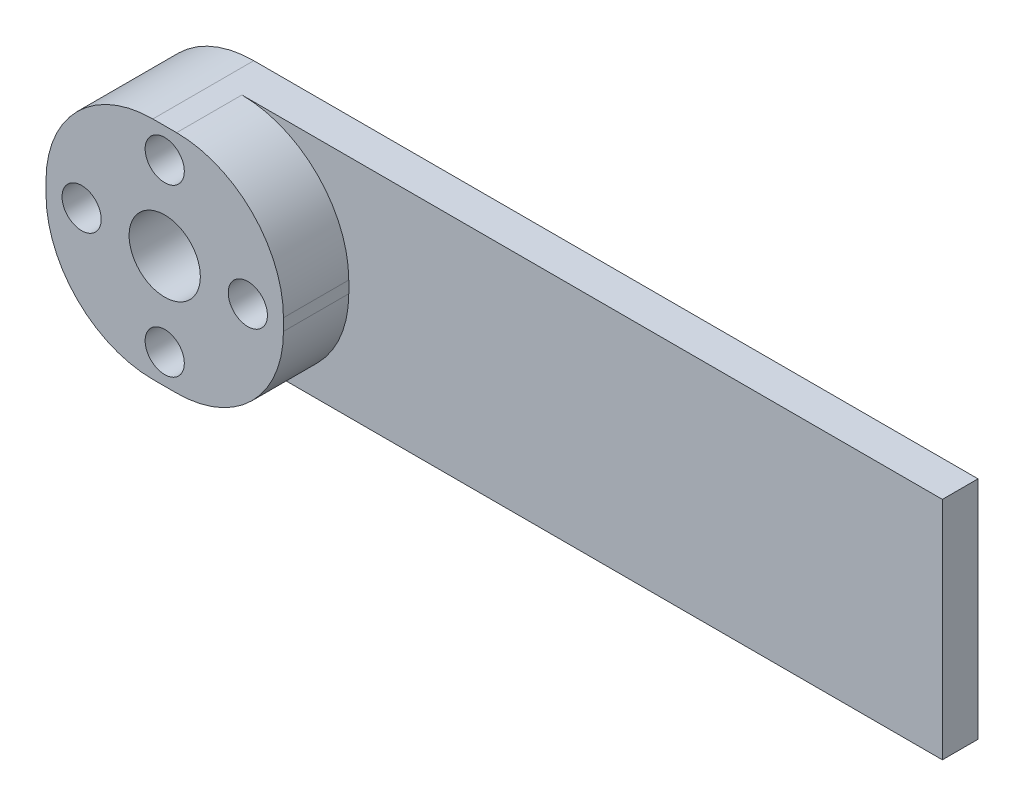
from build123d import *

# Parameters (mm, degrees)
SKETCH1_W           = 70
SKETCH1_H           = 19
SKETCH1_R           = 1.65
BOSS_EXTRUDE1_DEPTH = 3
SKETCH2_R           = 3
CUT_EXTRUDE1_DEPTH  = 3
FILLET2_R           = 9
SKETCH3_R           = 1.65
SKETCH3_R_2         = 3
BOSS_EXTRUDE2_DEPTH = 5.5
FILLET3_R           = 9


with BuildPart() as part:
    # Sketch1 → Boss-Extrude1 (new body)
    with BuildSketch(Plane.XY):
        with Locations((25, 0)):
            Rectangle(SKETCH1_W, SKETCH1_H)
        with Locations((0, 7)):
            Circle(SKETCH1_R, mode=Mode.SUBTRACT)
        with Locations((7, 0)):
            Circle(SKETCH1_R, mode=Mode.SUBTRACT)
        with Locations((0, -7)):
            Circle(SKETCH1_R, mode=Mode.SUBTRACT)
        with Locations((-7, 0)):
            Circle(SKETCH1_R, mode=Mode.SUBTRACT)
    extrude(amount=BOSS_EXTRUDE1_DEPTH)

    # Sketch2 → Cut-Extrude1 (cut)
    with BuildSketch(Plane.XY.offset(3)):
        Circle(SKETCH2_R)
    extrude(amount=-CUT_EXTRUDE1_DEPTH, mode=Mode.SUBTRACT)

    # Fillet2
    fillet2_edges = [part.edges().sort_by_distance(p)[0] for p in [
        (-10, -9.5, 1.5),
        (-10, 9.5, 1.5),
    ]]
    fillet(fillet2_edges, radius=FILLET2_R)

    # Sketch3 → Boss-Extrude2 (add)
    with BuildSketch(Plane.XY.offset(3)):
        with BuildLine():
            Line((-10, 0.5), (-10, -0.5))
            ThreePointArc((-10, -0.5), (-7.363961031, -6.863961031), (-1, -9.5))
            Line((-1, -9.5), (10, -9.5))
            Line((10, -9.5), (10, 9.5))
            Line((10, 9.5), (-1, 9.5))
            ThreePointArc((-1, 9.5), (-7.363961031, 6.863961031), (-10, 0.5))
        make_face()
        with Locations((0, 7)):
            Circle(SKETCH3_R, mode=Mode.SUBTRACT)
        with Locations((-7, 0)):
            Circle(SKETCH3_R, mode=Mode.SUBTRACT)
        with Locations((0, -7)):
            Circle(SKETCH3_R, mode=Mode.SUBTRACT)
        Circle(SKETCH3_R_2, mode=Mode.SUBTRACT)
        with Locations((7, 0)):
            Circle(SKETCH3_R, mode=Mode.SUBTRACT)
    extrude(amount=BOSS_EXTRUDE2_DEPTH)

    # Fillet3
    fillet3_edges = [part.edges().sort_by_distance(p)[0] for p in [
        (10, -9.5, 5.75),
        (10, 9.5, 5.75),
    ]]
    fillet(fillet3_edges, radius=FILLET3_R)


solid = part.part
